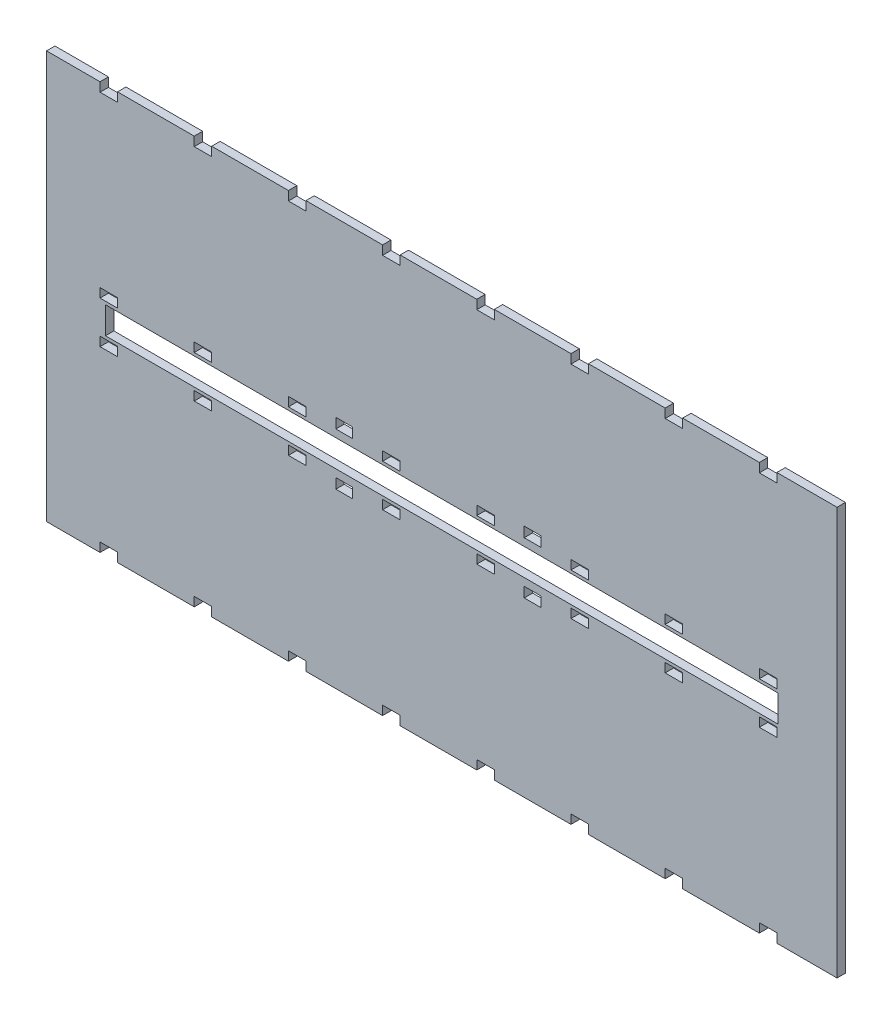
from build123d import *

# Parameters (mm, degrees)
SKETCH4_W                = 298.45
SKETCH4_H                = 38.1
SKETCH4_W_2              = 254
SKETCH4_H_2              = 10.16
BOSS_EXTRUDE1_DEPTH      = 3.175
SKETCH5_W                = 6.604
SKETCH5_H                = 3.429
CUT_EXTRUDE1_DEPTH       = 152.603161408
SKETCH7_W                = 298.45
SKETCH7_H                = 3.175
BOSS_EXTRUDE2_DEPTH      = 57.912
LPATTERN3_COUNT          = 2
LPATTERN3_PITCH          = 67.31
LPATTERN3_COUNT_DIR2     = 8
LPATTERN3_PITCH_DIR2     = 35.56
CUT_EXTRUDE2_DEPTH       = 169.94900264
LPATTERN2_COUNT          = 2
LPATTERN2_PITCH          = 71.12
MIRROR1_COPY_1_SKETCH_W  = 6.604
MIRROR1_COPY_1_SKETCH_H  = 3.429
MIRROR1_COPY_1_DEPTH     = 152.603161408
MIRROR1_COPY_2_SKETCH_W  = 6.604
MIRROR1_COPY_2_SKETCH_H  = 3.429
MIRROR1_COPY_2_DEPTH     = 152.603161408
MIRROR1_COPY_3_SKETCH_W  = 6.604
MIRROR1_COPY_3_SKETCH_H  = 3.429
MIRROR1_COPY_3_DEPTH     = 152.603161408
MIRROR1_COPY_4_SKETCH_W  = 6.604
MIRROR1_COPY_4_SKETCH_H  = 3.429
MIRROR1_COPY_4_DEPTH     = 152.603161408
MIRROR1_COPY_5_SKETCH_W  = 6.604
MIRROR1_COPY_5_SKETCH_H  = 3.429
MIRROR1_COPY_5_DEPTH     = 152.603161408
MIRROR1_COPY_6_SKETCH_W  = 6.604
MIRROR1_COPY_6_SKETCH_H  = 3.429
MIRROR1_COPY_6_DEPTH     = 152.603161408
MIRROR1_COPY_7_SKETCH_W  = 6.604
MIRROR1_COPY_7_SKETCH_H  = 3.429
MIRROR1_COPY_7_DEPTH     = 152.603161408
MIRROR1_COPY_8_SKETCH_W  = 6.604
MIRROR1_COPY_8_SKETCH_H  = 3.429
MIRROR1_COPY_8_DEPTH     = 152.603161408
MIRROR1_COPY_9_SKETCH_W  = 6.604
MIRROR1_COPY_9_SKETCH_H  = 3.429
MIRROR1_COPY_9_DEPTH     = 152.603161408
MIRROR1_COPY_10_SKETCH_W = 6.604
MIRROR1_COPY_10_SKETCH_H = 3.429
MIRROR1_COPY_10_DEPTH    = 152.603161408
MIRROR1_COPY_11_SKETCH_W = 6.604
MIRROR1_COPY_11_SKETCH_H = 3.429
MIRROR1_COPY_11_DEPTH    = 152.603161408
MIRROR1_COPY_12_SKETCH_W = 6.604
MIRROR1_COPY_12_SKETCH_H = 3.429
MIRROR1_COPY_12_DEPTH    = 152.603161408
MIRROR1_COPY_13_SKETCH_W = 6.604
MIRROR1_COPY_13_SKETCH_H = 3.429
MIRROR1_COPY_13_DEPTH    = 152.603161408
MIRROR1_COPY_14_SKETCH_W = 6.604
MIRROR1_COPY_14_SKETCH_H = 3.429
MIRROR1_COPY_14_DEPTH    = 152.603161408
MIRROR1_COPY_15_SKETCH_W = 6.604
MIRROR1_COPY_15_SKETCH_H = 3.429
MIRROR1_COPY_15_DEPTH    = 152.603161408
MIRROR1_COPY_16_DEPTH    = 169.94900264


with BuildPart() as part:
    # Sketch4 → Boss-Extrude1 (new body)
    with BuildSketch(Plane.XY):
        with Locations((-1.143, 0)):
            Rectangle(SKETCH4_W, SKETCH4_H)
        with Locations((-1.143, 0)):
            Rectangle(SKETCH4_W_2, SKETCH4_H_2, mode=Mode.SUBTRACT)
    extrude(amount=BOSS_EXTRUDE1_DEPTH)

    # Sketch5 → Cut-Extrude1 (cut, through all)
    with BuildSketch(Plane.XY.offset(3.175)):
        with Locations((-126.873, 7.9375)):
            Rectangle(SKETCH5_W, SKETCH5_H)
    cut_extrude1 = extrude(amount=-CUT_EXTRUDE1_DEPTH, mode=Mode.SUBTRACT)

    # Sketch7 → Boss-Extrude2 (add)
    with BuildSketch(Plane(origin=(0, 19.05, 0), x_dir=(1, 0, 0), z_dir=(0, 1, 0))):
        with Locations((-1.143, -1.5875)):
            Rectangle(SKETCH7_W, SKETCH7_H)
    boss_extrude2 = extrude(amount=BOSS_EXTRUDE2_DEPTH)

    # LPattern3: Cut-Extrude1 2 × 8
    with Locations(*[(j * LPATTERN3_PITCH_DIR2, i * LPATTERN3_PITCH, 0) for i in range(LPATTERN3_COUNT) for j in range(LPATTERN3_COUNT_DIR2) if (i, j) != (0, 0)]):
        add(cut_extrude1, mode=Mode.SUBTRACT)

    # Sketch6 → Cut-Extrude2 (cut, through all)
    with BuildSketch(Plane(origin=(0, 0, 0), x_dir=(-1, 0, 0), z_dir=(0, 0, -1))):
        Polygon((37.973, 7.9375), (41.148, 7.9375), (41.148, 11.7475), (37.973, 11.7475), (34.798, 11.7475), (34.798, 7.9375), align=None)
    cut_extrude2 = extrude(amount=-CUT_EXTRUDE2_DEPTH, mode=Mode.SUBTRACT)

    # LPattern2: Cut-Extrude2 ×2
    with Locations(*[(i * LPATTERN2_PITCH, 0, 0) for i in range(1, LPATTERN2_COUNT)]):
        add(cut_extrude2, mode=Mode.SUBTRACT)

    # Mirror1: Cut-Extrude1, Boss-Extrude2, Cut-Extrude2 across plane
    add(cut_extrude1.mirror(Plane.ZX), mode=Mode.SUBTRACT)
    add(boss_extrude2.mirror(Plane.ZX))
    add(cut_extrude2.mirror(Plane.ZX), mode=Mode.SUBTRACT)

    # Mirror1 copy 1 sketch → Mirror1 copy 1 (cut, through all)
    with BuildSketch(Plane(origin=(35.56, 0, 3.175), x_dir=(1, 0, 0), z_dir=(0, 0, 1))):
        with Locations((-126.873, -7.9375)):
            Rectangle(MIRROR1_COPY_1_SKETCH_W, MIRROR1_COPY_1_SKETCH_H)
    extrude(amount=-MIRROR1_COPY_1_DEPTH, mode=Mode.SUBTRACT)

    # Mirror1 copy 2 sketch → Mirror1 copy 2 (cut, through all)
    with BuildSketch(Plane(origin=(71.12, 0, 3.175), x_dir=(1, 0, 0), z_dir=(0, 0, 1))):
        with Locations((-126.873, -7.9375)):
            Rectangle(MIRROR1_COPY_2_SKETCH_W, MIRROR1_COPY_2_SKETCH_H)
    extrude(amount=-MIRROR1_COPY_2_DEPTH, mode=Mode.SUBTRACT)

    # Mirror1 copy 3 sketch → Mirror1 copy 3 (cut, through all)
    with BuildSketch(Plane(origin=(106.68, 0, 3.175), x_dir=(1, 0, 0), z_dir=(0, 0, 1))):
        with Locations((-126.873, -7.9375)):
            Rectangle(MIRROR1_COPY_3_SKETCH_W, MIRROR1_COPY_3_SKETCH_H)
    extrude(amount=-MIRROR1_COPY_3_DEPTH, mode=Mode.SUBTRACT)

    # Mirror1 copy 4 sketch → Mirror1 copy 4 (cut, through all)
    with BuildSketch(Plane(origin=(142.24, 0, 3.175), x_dir=(1, 0, 0), z_dir=(0, 0, 1))):
        with Locations((-126.873, -7.9375)):
            Rectangle(MIRROR1_COPY_4_SKETCH_W, MIRROR1_COPY_4_SKETCH_H)
    extrude(amount=-MIRROR1_COPY_4_DEPTH, mode=Mode.SUBTRACT)

    # Mirror1 copy 5 sketch → Mirror1 copy 5 (cut, through all)
    with BuildSketch(Plane(origin=(177.8, 0, 3.175), x_dir=(1, 0, 0), z_dir=(0, 0, 1))):
        with Locations((-126.873, -7.9375)):
            Rectangle(MIRROR1_COPY_5_SKETCH_W, MIRROR1_COPY_5_SKETCH_H)
    extrude(amount=-MIRROR1_COPY_5_DEPTH, mode=Mode.SUBTRACT)

    # Mirror1 copy 6 sketch → Mirror1 copy 6 (cut, through all)
    with BuildSketch(Plane(origin=(213.36, 0, 3.175), x_dir=(1, 0, 0), z_dir=(0, 0, 1))):
        with Locations((-126.873, -7.9375)):
            Rectangle(MIRROR1_COPY_6_SKETCH_W, MIRROR1_COPY_6_SKETCH_H)
    extrude(amount=-MIRROR1_COPY_6_DEPTH, mode=Mode.SUBTRACT)

    # Mirror1 copy 7 sketch → Mirror1 copy 7 (cut, through all)
    with BuildSketch(Plane(origin=(248.92, 0, 3.175), x_dir=(1, 0, 0), z_dir=(0, 0, 1))):
        with Locations((-126.873, -7.9375)):
            Rectangle(MIRROR1_COPY_7_SKETCH_W, MIRROR1_COPY_7_SKETCH_H)
    extrude(amount=-MIRROR1_COPY_7_DEPTH, mode=Mode.SUBTRACT)

    # Mirror1 copy 8 sketch → Mirror1 copy 8 (cut, through all)
    with BuildSketch(Plane(origin=(0, -67.31, 3.175), x_dir=(1, 0, 0), z_dir=(0, 0, 1))):
        with Locations((-126.873, -7.9375)):
            Rectangle(MIRROR1_COPY_8_SKETCH_W, MIRROR1_COPY_8_SKETCH_H)
    extrude(amount=-MIRROR1_COPY_8_DEPTH, mode=Mode.SUBTRACT)

    # Mirror1 copy 9 sketch → Mirror1 copy 9 (cut, through all)
    with BuildSketch(Plane(origin=(35.56, -67.31, 3.175), x_dir=(1, 0, 0), z_dir=(0, 0, 1))):
        with Locations((-126.873, -7.9375)):
            Rectangle(MIRROR1_COPY_9_SKETCH_W, MIRROR1_COPY_9_SKETCH_H)
    extrude(amount=-MIRROR1_COPY_9_DEPTH, mode=Mode.SUBTRACT)

    # Mirror1 copy 10 sketch → Mirror1 copy 10 (cut, through all)
    with BuildSketch(Plane(origin=(71.12, -67.31, 3.175), x_dir=(1, 0, 0), z_dir=(0, 0, 1))):
        with Locations((-126.873, -7.9375)):
            Rectangle(MIRROR1_COPY_10_SKETCH_W, MIRROR1_COPY_10_SKETCH_H)
    extrude(amount=-MIRROR1_COPY_10_DEPTH, mode=Mode.SUBTRACT)

    # Mirror1 copy 11 sketch → Mirror1 copy 11 (cut, through all)
    with BuildSketch(Plane(origin=(106.68, -67.31, 3.175), x_dir=(1, 0, 0), z_dir=(0, 0, 1))):
        with Locations((-126.873, -7.9375)):
            Rectangle(MIRROR1_COPY_11_SKETCH_W, MIRROR1_COPY_11_SKETCH_H)
    extrude(amount=-MIRROR1_COPY_11_DEPTH, mode=Mode.SUBTRACT)

    # Mirror1 copy 12 sketch → Mirror1 copy 12 (cut, through all)
    with BuildSketch(Plane(origin=(142.24, -67.31, 3.175), x_dir=(1, 0, 0), z_dir=(0, 0, 1))):
        with Locations((-126.873, -7.9375)):
            Rectangle(MIRROR1_COPY_12_SKETCH_W, MIRROR1_COPY_12_SKETCH_H)
    extrude(amount=-MIRROR1_COPY_12_DEPTH, mode=Mode.SUBTRACT)

    # Mirror1 copy 13 sketch → Mirror1 copy 13 (cut, through all)
    with BuildSketch(Plane(origin=(177.8, -67.31, 3.175), x_dir=(1, 0, 0), z_dir=(0, 0, 1))):
        with Locations((-126.873, -7.9375)):
            Rectangle(MIRROR1_COPY_13_SKETCH_W, MIRROR1_COPY_13_SKETCH_H)
    extrude(amount=-MIRROR1_COPY_13_DEPTH, mode=Mode.SUBTRACT)

    # Mirror1 copy 14 sketch → Mirror1 copy 14 (cut, through all)
    with BuildSketch(Plane(origin=(213.36, -67.31, 3.175), x_dir=(1, 0, 0), z_dir=(0, 0, 1))):
        with Locations((-126.873, -7.9375)):
            Rectangle(MIRROR1_COPY_14_SKETCH_W, MIRROR1_COPY_14_SKETCH_H)
    extrude(amount=-MIRROR1_COPY_14_DEPTH, mode=Mode.SUBTRACT)

    # Mirror1 copy 15 sketch → Mirror1 copy 15 (cut, through all)
    with BuildSketch(Plane(origin=(248.92, -67.31, 3.175), x_dir=(1, 0, 0), z_dir=(0, 0, 1))):
        with Locations((-126.873, -7.9375)):
            Rectangle(MIRROR1_COPY_15_SKETCH_W, MIRROR1_COPY_15_SKETCH_H)
    extrude(amount=-MIRROR1_COPY_15_DEPTH, mode=Mode.SUBTRACT)

    # Mirror1 copy 16 sketch → Mirror1 copy 16 (cut, through all)
    with BuildSketch(Plane(origin=(71.12, 0, 0), x_dir=(-1, 0, 0), z_dir=(0, 0, -1))):
        Polygon((37.973, -7.9375), (41.148, -7.9375), (41.148, -11.7475), (37.973, -11.7475), (34.798, -11.7475), (34.798, -7.9375), align=None)
    extrude(amount=-MIRROR1_COPY_16_DEPTH, mode=Mode.SUBTRACT)


solid = part.part
